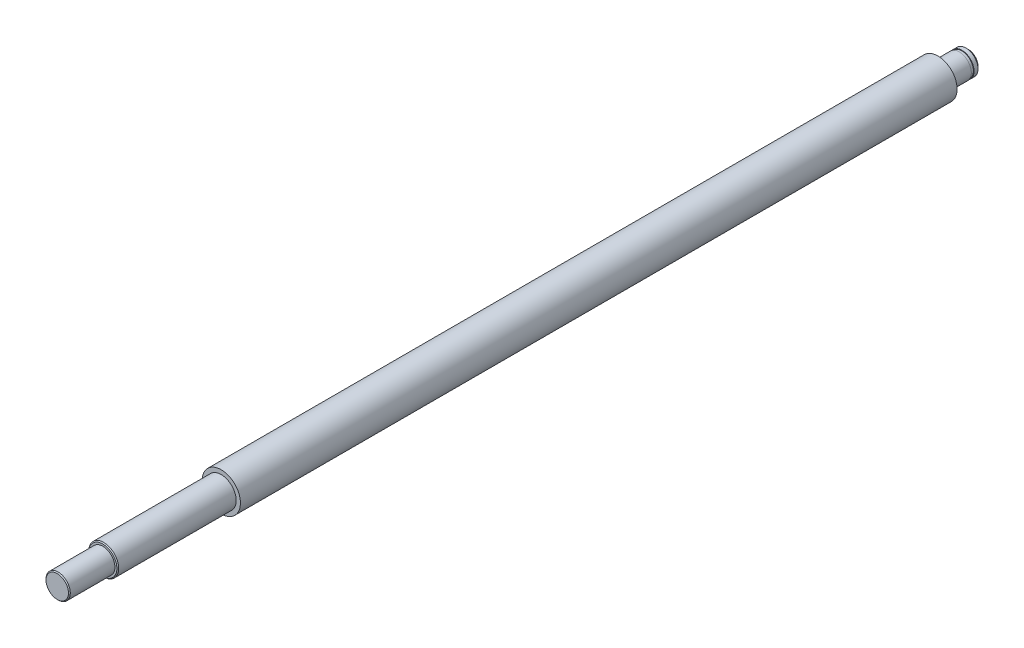
from build123d import *

# Parameters (mm, degrees)
SKETCH2_W     = 0.9
SKETCH2_H     = 0.2
CHAMFER1_SIZE = 0.8
CHAMFER2_SIZE = 0.3


with BuildPart() as part:
    # Sketch1 → Revolve1 (revolve)
    with BuildSketch(Plane(origin=(0, 0, 0), x_dir=(0, 0, -1), z_dir=(1, 0, 0)), mode=Mode.PRIVATE) as revolve1_sk:
        Polygon((-150, 0), (150, 0), (150, 4), (140, 4), (140, 6.32), (-96, 6.32), (-96, 4.94), (-135, 4.94), (-135, 4), (-150, 4), align=None)
    revolve(revolve1_sk.sketch.rotate(Axis((0, 0, 150), (0, 0, -1)), 90), axis=Axis((0, 0, 150), (0, 0, -1)))

    # Sketch2 → Cut-Revolve1 (revolve, cut)
    with BuildSketch(Plane(origin=(0, 0, 0), x_dir=(0, 0, -1), z_dir=(1, 0, 0)), mode=Mode.PRIVATE) as cut_revolve1_sk:
        with Locations((147.45, 3.9)):
            Rectangle(SKETCH2_W, SKETCH2_H)
    revolve(cut_revolve1_sk.sketch.rotate(Axis((0, 0, -150), (0, 0, 1)), 270), axis=Axis((0, 0, -150), (0, 0, 1)), mode=Mode.SUBTRACT)

    # Chamfer1
    chamfer1_edges = [part.edges().sort_by_distance(p)[0] for p in [
        (-4, 0, -150),
    ]]
    chamfer(chamfer1_edges, length=CHAMFER1_SIZE)

    # Chamfer2
    chamfer2_edges = [part.edges().sort_by_distance(p)[0] for p in [
        (-4.94, 0, 135),
        (-4, 0, 150),
    ]]
    chamfer(chamfer2_edges, length=CHAMFER2_SIZE)


solid = part.part
